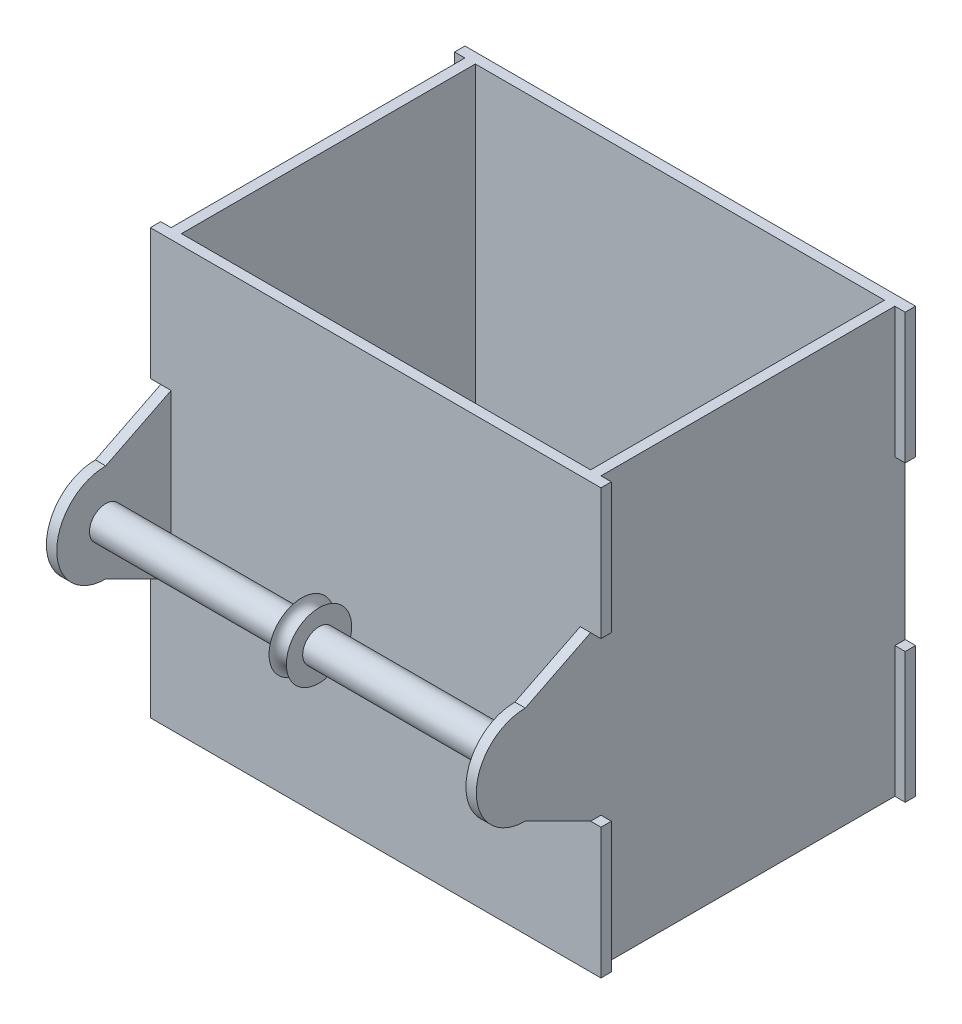
from build123d import *

# Parameters (mm, degrees)
BOSS_EXTRUDE1_DEPTH = 3.175
SKETCH3_W           = 3.175
SKETCH3_H           = 130
BOSS_EXTRUDE2_DEPTH = 90
BOSS_EXTRUDE3_DEPTH = 3.175
BOSS_EXTRUDE4_DEPTH = 3.175
BOSS_EXTRUDE5_START = -3.175
BOSS_EXTRUDE5_DEPTH = 3.175
SKETCH7_R           = 5
BOSS_EXTRUDE6_DEPTH = 128.475
SKETCH8_R           = 10
BOSS_EXTRUDE7_DEPTH = 5.3
SKETCH10_R          = 2.65


with BuildPart() as part:
    # Sketch2 → Boss-Extrude1 (new body)
    with BuildSketch(Plane.XY):
        Polygon((0, 50), (-3.175, 50), (-3.175, 90), (134.825, 90), (134.825, 50), (131.65, 50), (131.65, 0), (134.825, 0), (134.825, -40), (-3.175, -40), (-3.175, 0), (0, 0), align=None)
    extrude(amount=BOSS_EXTRUDE1_DEPTH)

    # Sketch3 → Boss-Extrude2 (add)
    with BuildSketch(Plane.XY.offset(3.175)):
        with Locations((1.5875, 25)):
            Rectangle(SKETCH3_W, SKETCH3_H)
        with Locations((130.0625, 25)):
            Rectangle(SKETCH3_W, SKETCH3_H)
    extrude(amount=BOSS_EXTRUDE2_DEPTH)

    # Sketch4 → Boss-Extrude3 (add)
    with BuildSketch(Plane.XY.offset(93.175)):
        Polygon((131.65, 50), (134.825, 50), (134.825, 90), (-3.175, 90), (-3.175, 50), (-1.5875, 50), (0, 50), (0, 0), (-3.175, 0), (-3.175, -40), (134.825, -40), (134.825, 0), (131.65, 0), align=None)
    extrude(amount=BOSS_EXTRUDE3_DEPTH)

    # Sketch5 → Boss-Extrude4 (add)
    with BuildSketch(Plane.ZY):
        with BuildLine():
            Line((96.35, 50), (96.35, 0))
            Line((96.35, 0), (116.35, 10))
            ThreePointArc((116.35, 10), (131.35, 25), (116.35, 40))
            Line((116.35, 40), (96.35, 50))
        make_face()
    extrude(amount=-BOSS_EXTRUDE4_DEPTH)

    # Sketch6 → Boss-Extrude5 (add)
    with BuildSketch(Plane(origin=(131.65, 0, 0), x_dir=(0, 0, -1), z_dir=(1, 0, 0)).offset(BOSS_EXTRUDE5_START)):
        with BuildLine():
            Line((-96.35, 0), (-116.35, 10))
            ThreePointArc((-116.35, 10), (-131.35, 25), (-116.35, 40))
            Line((-116.35, 40), (-96.35, 50))
            Line((-96.35, 50), (-96.35, 0))
        make_face()
    extrude(amount=BOSS_EXTRUDE5_DEPTH)

    # Sketch7 → Boss-Extrude6 (add)
    with BuildSketch(Plane(origin=(131.65, 0, 0), x_dir=(0, 0, -1), z_dir=(1, 0, 0))):
        with Locations((-116.35, 25)):
            Circle(SKETCH7_R)
    extrude(amount=-BOSS_EXTRUDE6_DEPTH)

    # Sketch8 → Boss-Extrude7 (add)
    with BuildSketch(Plane.ZY.offset(-68.475)):
        with Locations((116.35, 25)):
            Circle(SKETCH8_R)
    extrude(amount=BOSS_EXTRUDE7_DEPTH)

    # Sketch10 → Cut-Revolve1 (revolve, cut)
    with BuildSketch(Plane(origin=(0, 25, 0), x_dir=(1, 0, 0), z_dir=(0, 1, 0)), mode=Mode.PRIVATE) as cut_revolve1_sk:
        with Locations((65.825, -106.35)):
            Circle(SKETCH10_R)
    revolve(cut_revolve1_sk.sketch.rotate(Axis((63.175, 25, 116.35), (-1, 0, 0)), 180), axis=Axis((63.175, 25, 116.35), (-1, 0, 0)), mode=Mode.SUBTRACT)


solid = part.part
